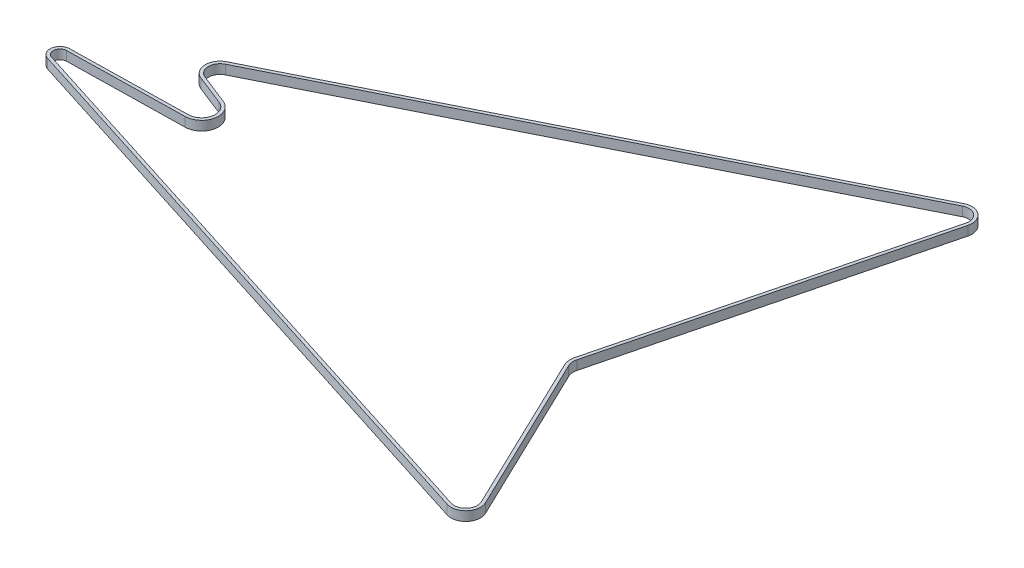
from build123d import *

# Parameters (mm, degrees)
EXTRUDE_THIN1_DEPTH = 6


with BuildPart() as part:
    # Sketch1 → Extrude-Thin1 (new body)
    with BuildSketch(Plane(origin=(0, 86.8, 0), x_dir=(1, 0, 0), z_dir=(0, 1, 0))):
        with BuildLine():
            Line((153.976470843, 166.722058314), (-162.473529157, 8.497058315))
            ThreePointArc((-162.473529157, 8.497058314), (-167.715732066, -0.419529316), (-161.707213549, -8.838788876))
            Line((-161.707213549, -8.838788876), (-142.250173329, -16.504269977))
            ThreePointArc((-142.250173329, -16.504269977), (-136.846395058, -26.198255989), (-145.296171508, -33.393772811))
            Line((-145.296171508, -33.393772811), (-220.267521321, -34.776083328))
            ThreePointArc((-220.267521321, -34.776083328), (-226.458318107, -40.230354602), (-222.082372691, -47.225077019))
            Line((-222.082372691, -47.225077019), (155.345385794, -167.278055949))
            ThreePointArc((155.345385794, -167.278055949), (165.396500417, -164.455536235), (166.786864342, -154.108632792))
            Line((166.786864342, -154.108632792), (117.114072317, -50.79139085))
            ThreePointArc((117.114072317, -50.79139085), (116.29360588, -47.872468586), (116.518563148, -44.848784313))
            Line((116.518563148, -44.848784313), (167.433417153, 155.889394397))
            ThreePointArc((167.433417153, 155.889394397), (164.182077649, 165.625217962), (153.976470843, 166.722058314))
        make_face()
        with BuildLine():
            Line((154.870898034, 164.933203932), (-161.579101966, 6.708203933))
            ThreePointArc((-161.579101966, 6.708203933), (-165.71768321, -0.331207355), (-160.97411596, -6.977991218))
            Line((-160.97411596, -6.977991218), (-141.517075739, -14.643472319))
            ThreePointArc((-141.517075739, -14.643472319), (-134.87814815, -26.553226562), (-145.259302074, -35.393432943))
            Line((-145.259302074, -35.393432943), (-220.230651887, -36.775743461))
            ThreePointArc((-220.230651887, -36.775743461), (-224.479237917, -40.518870805), (-221.476138121, -45.319170503))
            Line((-221.476138121, -45.319170503), (155.951620364, -165.372149434))
            ThreePointArc((155.951620364, -165.372149434), (163.886710855, -163.143844396), (164.984366586, -154.975236414))
            Line((164.984366586, -154.975236414), (115.311574561, -51.657994473))
            ThreePointArc((115.311574561, -51.657994473), (114.303572939, -48.071889977), (114.579949011, -44.35707787))
            Line((114.579949011, -44.35707787), (165.494803016, 156.38110084))
            ThreePointArc((165.494803016, 156.38110084), (162.927956039, 164.067277338), (154.870898034, 164.933203932))
        make_face(mode=Mode.SUBTRACT)
    extrude(amount=EXTRUDE_THIN1_DEPTH)


solid = part.part
